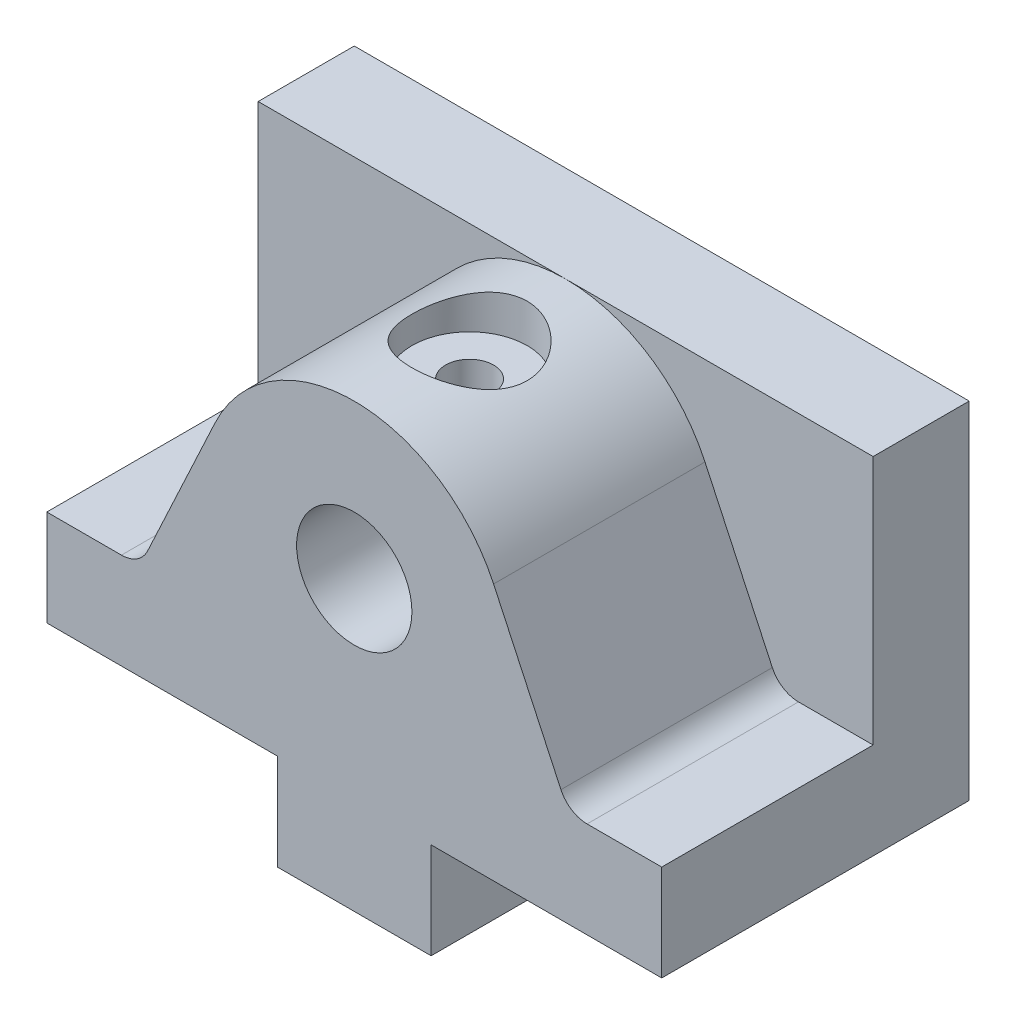
from build123d import *

# Parameters (mm, degrees)
SKETCH1_R                  = 6
BOSS_EXTRUDE1_DEPTH        = 22
SKETCH2_R                  = 6
BOSS_EXTRUDE2_DEPTH        = 10
BOSS_EXTRUDE3_START        = -8
SKETCH3_R                  = 6
BOSS_EXTRUDE3_DEPTH        = 8
M6X1_0_TAPPED_HOLE1_D      = 5
M6X1_0_TAPPED_HOLE1_DEPTH  = 16
M6X1_0_TAPPED_HOLE1_TIP    = 1.443375673
SKETCH6_R                  = 6
CUT_EXTRUDE1_DEPTH         = 4
M6X1_0_TAPPED_HOLE2_REACH  = 63.741
M6X1_0_TAPPED_HOLE2_BORE_R = 2.5


with BuildPart() as part:
    # Sketch1 → Boss-Extrude1 (new body)
    with BuildSketch(Plane.XY):
        with BuildLine():
            Line((-8, 0), (8, 0))
            Line((8, 0), (8, 10))
            Line((8, 10), (32, 10))
            Line((32, 10), (32, 20))
            Line((32, 20), (24.228334067, 20))
            ThreePointArc((24.228334067, 20), (22.616435242, 20.469825663), (21.509410706, 21.732145215))
            Line((21.509410706, 21.732145215), (14.500924593, 36.761892188))
            ThreePointArc((14.500924593, 36.761892188), (0, 46), (-14.500924593, 36.761892188))
            Line((-14.500924593, 36.761892188), (-21.509410706, 21.732145215))
            ThreePointArc((-21.509410706, 21.732145215), (-22.616435242, 20.469825663), (-24.228334067, 20))
            Line((-24.228334067, 20), (-32, 20))
            Line((-32, 20), (-32, 10))
            Line((-32, 10), (-8, 10))
            Line((-8, 10), (-8, 0))
        make_face()
        with Locations((0, 30)):
            Circle(SKETCH1_R, mode=Mode.SUBTRACT)
    extrude(amount=-BOSS_EXTRUDE1_DEPTH)

    # Sketch2 → Boss-Extrude2 (add)
    with BuildSketch(Plane(origin=(0, 0, -22), x_dir=(-1, 0, 0), z_dir=(0, 0, -1))):
        Polygon((-32, 10), (-32, 46), (32, 46), (32, 10), (8, 10), (8, 0), (-8, 0), (-8, 10), align=None)
        with Locations(Location((0, 30, 0), (0, 0, 180))):
            Circle(SKETCH2_R, mode=Mode.SUBTRACT)
    extrude(amount=BOSS_EXTRUDE2_DEPTH)

    # Sketch3 → Boss-Extrude3 (add)
    with BuildSketch(Plane(origin=(0, 0, -32), x_dir=(-1, 0, 0), z_dir=(0, 0, -1)).offset(BOSS_EXTRUDE3_START)):
        with Locations(Location((0, 30, 0), (0, 0, 180))):
            Circle(SKETCH3_R)
    extrude(amount=BOSS_EXTRUDE3_DEPTH)

    # M6x1.0 Tapped Hole1
    with Locations(Plane(origin=(0, 0, 0), x_dir=(-1, 0, 0), z_dir=(0, -1, 0))):
        with Locations((0, 8), (0, 24)):
            Hole(M6X1_0_TAPPED_HOLE1_D / 2, depth=M6X1_0_TAPPED_HOLE1_DEPTH)
            with Locations((0, 0, -(M6X1_0_TAPPED_HOLE1_DEPTH + M6X1_0_TAPPED_HOLE1_TIP / 2))):  # 120° drill point
                Cone(0, M6X1_0_TAPPED_HOLE1_D / 2, M6X1_0_TAPPED_HOLE1_TIP, mode=Mode.SUBTRACT)

    # Sketch6 → Cut-Extrude1 (cut)
    with BuildSketch(Plane(origin=(0, 42, 0), x_dir=(1, 0, 0), z_dir=(0, 1, 0))):
        with Locations(Location((0, 12, 0), (0, 0, 90))):
            Circle(SKETCH6_R)
    extrude(amount=CUT_EXTRUDE1_DEPTH, mode=Mode.SUBTRACT)

    # M6x1.0 Tapped Hole2 bore → M6x1.0 Tapped Hole2 (cut, up to next)
    with BuildSketch(Plane(origin=(0, 42, 0), x_dir=(1, 0, 0), z_dir=(0, 1, 0)), mode=Mode.PRIVATE) as m6x1_0_tapped_hole2_sk1:
        with Locations((0, 12)):
            Circle(M6X1_0_TAPPED_HOLE2_BORE_R)
    m6x1_0_tapped_hole2_tool1 = extrude(m6x1_0_tapped_hole2_sk1.sketch, amount=-M6X1_0_TAPPED_HOLE2_REACH, mode=Mode.PRIVATE) & part.part
    add(m6x1_0_tapped_hole2_tool1.solids().sort_by_distance((0, 42, -12))[0], mode=Mode.SUBTRACT)


solid = part.part
